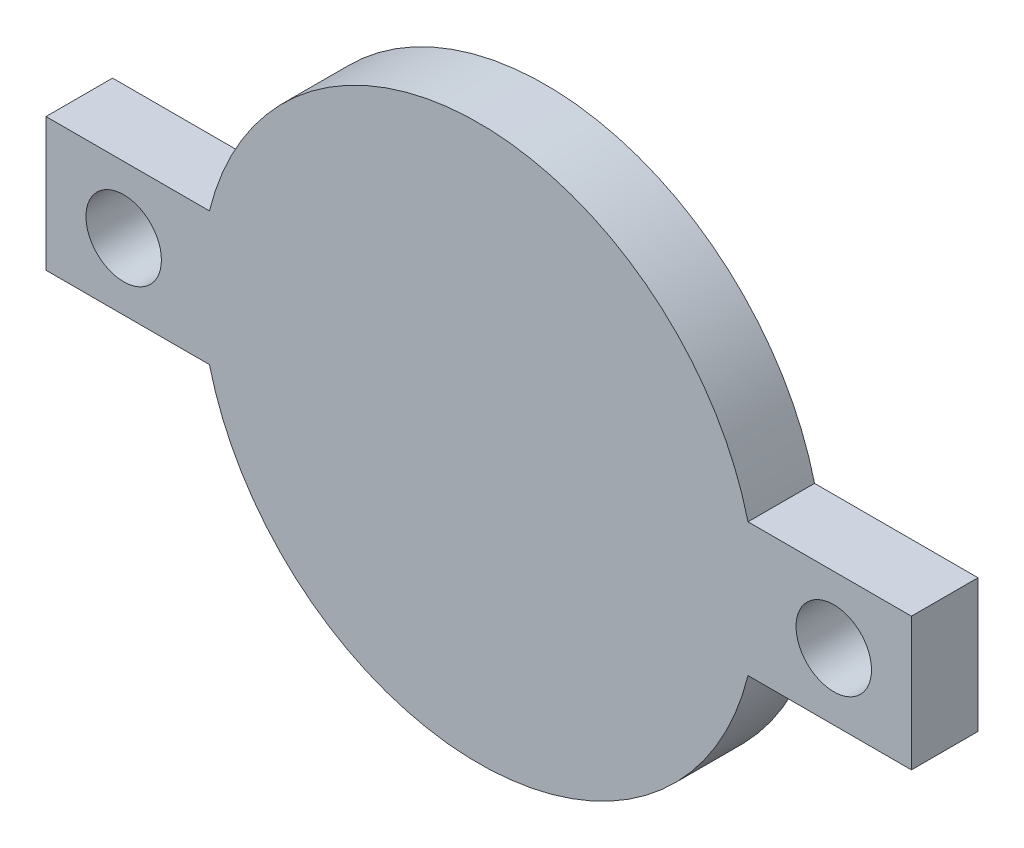
from build123d import *

# Parameters (mm, degrees)
SKETCH2_R           = 1.7
BOSS_EXTRUDE1_DEPTH = 3
SKETCH3_R           = 10.2
CUT_EXTRUDE1_DEPTH  = 1


with BuildPart() as part:
    # Sketch2 → Boss-Extrude1 (new body)
    # profile 1 of 7: a face of its own
    with BuildSketch(Plane.XY):
        with BuildLine():
            ThreePointArc((-17.5, 0), (-17.591670867, -1.511081774), (-17.8653389, -3))
            Line((-17.8653389, -3), (-10.5, -3))
            Line((-10.5, -3), (-10.5, 3))
            Line((-10.5, 3), (-17.8653389, 3))
            ThreePointArc((-17.8653389, 3), (-17.591670867, 1.511081774), (-17.5, 0))
        make_face()
        with Locations((-14, 0)):
            Circle(SKETCH2_R, mode=Mode.SUBTRACT)
    # profile 2 of 7: a face of its own
    with BuildSketch(Plane.XY):
        with BuildLine():
            ThreePointArc((-19.8, 0), (-20.868461247, -4.544777222), (-23.85, -8.137413594))
            Line((-23.85, -8.137413594), (-23.85, -10.882439984))
            ThreePointArc((-23.85, -10.882439984), (-20.044327099, -7.558741767), (-17.8653389, -3))
            ThreePointArc((-17.8653389, -3), (-17.591670867, -1.511081774), (-17.5, 0))
            ThreePointArc((-17.5, 0), (-17.591670867, 1.511081774), (-17.8653389, 3))
            ThreePointArc((-17.8653389, 3), (-20.044327099, 7.558741767), (-23.85, 10.882439984))
            Line((-23.85, 10.882439984), (-23.85, 8.137413594))
            ThreePointArc((-23.85, 8.137413594), (-20.868461247, 4.544777222), (-19.8, 0))
        make_face()
    # profile 3 of 7: a face of its own
    with BuildSketch(Plane.XY):
        with BuildLine():
            Line((-23.85, -10.882439984), (-23.85, -8.137413594))
            ThreePointArc((-23.85, -8.137413594), (-30, -10.2), (-36.15, -8.137413594))
            Line((-36.15, -8.137413594), (-36.15, -10.882439984))
            ThreePointArc((-36.15, -10.882439984), (-30, -12.5), (-23.85, -10.882439984))
        make_face()
    # profile 4 of 7: a face of its own
    with BuildSketch(Plane.XY):
        with BuildLine():
            Line((-36.15, -10.882439984), (-36.15, -8.137413594))
            ThreePointArc((-36.15, -8.137413594), (-40.2, 0), (-36.15, 8.137413594))
            Line((-36.15, 8.137413594), (-36.15, 10.882439984))
            ThreePointArc((-36.15, 10.882439984), (-39.955672901, 7.558741767), (-42.1346611, 3))
            ThreePointArc((-42.1346611, 3), (-42.5, 0), (-42.1346611, -3))
            ThreePointArc((-42.1346611, -3), (-39.955672901, -7.558741767), (-36.15, -10.882439984))
        make_face()
    # profile 5 of 7: a face of its own
    with BuildSketch(Plane.XY):
        with BuildLine():
            ThreePointArc((-36.15, -8.137413594), (-30, -10.2), (-23.85, -8.137413594))
            ThreePointArc((-23.85, -8.137413594), (-20.868461247, -4.544777222), (-19.8, 0))
            ThreePointArc((-19.8, 0), (-20.868461247, 4.544777222), (-23.85, 8.137413594))
            ThreePointArc((-23.85, 8.137413594), (-30, 10.2), (-36.15, 8.137413594))
            ThreePointArc((-36.15, 8.137413594), (-40.2, 0), (-36.15, -8.137413594))
        make_face()
    # profile 6 of 7: a face of its own
    with BuildSketch(Plane.XY):
        with BuildLine():
            Line((-36.15, 10.882439984), (-36.15, 8.137413594))
            ThreePointArc((-36.15, 8.137413594), (-30, 10.2), (-23.85, 8.137413594))
            Line((-23.85, 8.137413594), (-23.85, 10.882439984))
            ThreePointArc((-23.85, 10.882439984), (-30, 12.5), (-36.15, 10.882439984))
        make_face()
    # profile 7 of 7: a face of its own
    with BuildSketch(Plane.XY):
        with BuildLine():
            Line((-49.5, -3), (-42.1346611, -3))
            ThreePointArc((-42.1346611, -3), (-42.5, 0), (-42.1346611, 3))
            Line((-42.1346611, 3), (-49.5, 3))
            Line((-49.5, 3), (-49.5, -3))
        make_face()
        with Locations((-46, 0)):
            Circle(SKETCH2_R, mode=Mode.SUBTRACT)
    extrude(amount=BOSS_EXTRUDE1_DEPTH)

    # Sketch3 → Cut-Extrude1 (cut)
    with BuildSketch(Plane(origin=(0, 0, 0), x_dir=(-1, 0, 0), z_dir=(0, 0, -1))):
        with Locations((30, 0)):
            Circle(SKETCH3_R)
    extrude(amount=-CUT_EXTRUDE1_DEPTH, mode=Mode.SUBTRACT)


solid = part.part
